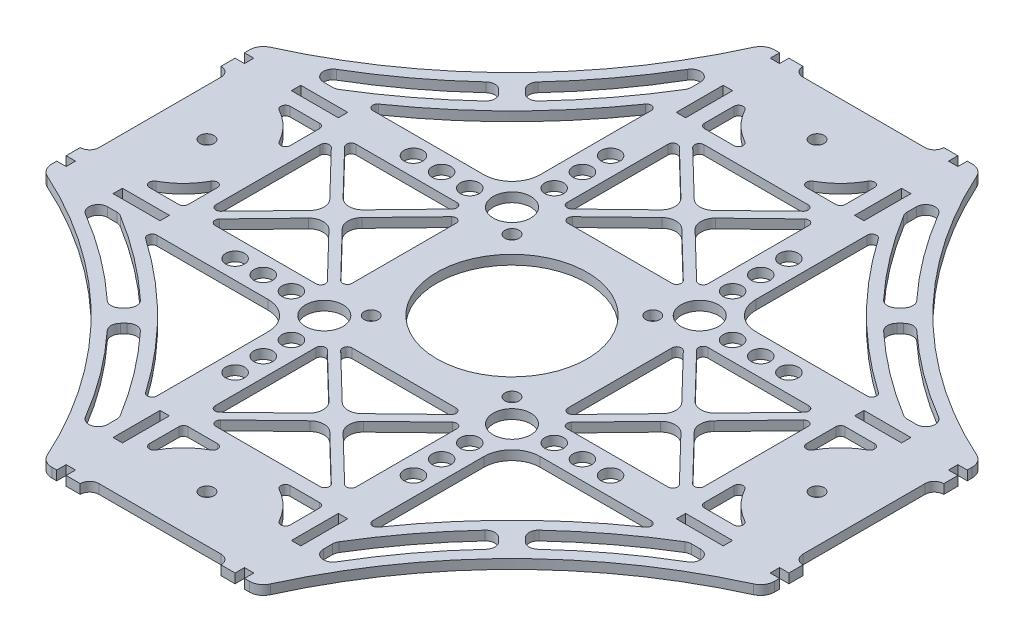
from build123d import *

# Parameters (mm, degrees)
SKETCH1_R           = 16
SKETCH1_R_2         = 1.5
SKETCH1_R_3         = 4
SKETCH1_R_4         = 2
SKETCH1_W           = 2
SKETCH1_H           = 10
SKETCH1_W_2         = 10
SKETCH1_H_2         = 2
BOSS_EXTRUDE1_DEPTH = 2


with BuildPart() as part:
    # Sketch1 → Boss-Extrude1 (new body)
    with BuildSketch(Plane(origin=(0, 0, 0), x_dir=(1, 0, 0), z_dir=(0, 1, 0))):
        with BuildLine():
            Line((-21.047576382, 77), (-20, 77))
            Line((-20, 77), (-20, 75))
            Line((-20, 75), (-18, 75))
            Line((-18, 75), (-18, 77))
            Line((-18, 77), (-15, 77))
            ThreePointArc((-15, 77), (-14.414213562, 75.585786438), (-13, 75))
            Line((-13, 75), (13, 75))
            ThreePointArc((13, 75), (14.414213562, 75.585786438), (15, 77))
            Line((15, 77), (18, 77))
            Line((18, 77), (18, 75))
            Line((18, 75), (20, 75))
            Line((20, 75), (20, 77))
            Line((20, 77), (21.047576382, 77))
            ThreePointArc((21.047576382, 77), (22.672345392, 76.521928957), (23.779277725, 75.240083776))
            ThreePointArc((23.779277725, 75.240083776), (44.837422207, 44.837422207), (75.240083776, 23.779277725))
            ThreePointArc((75.240083776, 23.779277725), (76.521928957, 22.672345392), (77, 21.047576382))
            Line((77, 21.047576382), (77, 20))
            Line((77, 20), (75, 20))
            Line((75, 20), (75, 18))
            Line((75, 18), (77, 18))
            Line((77, 18), (77, 15))
            ThreePointArc((77, 15), (75.585786438, 14.414213562), (75, 13))
            Line((75, 13), (75, -13))
            ThreePointArc((75, -13), (75.585786438, -14.414213562), (77, -15))
            Line((77, -15), (77, -18))
            Line((77, -18), (75, -18))
            Line((75, -18), (75, -20))
            Line((75, -20), (77, -20))
            Line((77, -20), (77, -21.047576382))
            ThreePointArc((77, -21.047576382), (76.521928957, -22.672345392), (75.240083776, -23.779277725))
            ThreePointArc((75.240083776, -23.779277725), (44.837422207, -44.837422207), (23.779277725, -75.240083776))
            ThreePointArc((23.779277725, -75.240083776), (22.672345392, -76.521928957), (21.047576382, -77))
            Line((21.047576382, -77), (20, -77))
            Line((20, -77), (20, -75))
            Line((20, -75), (18, -75))
            Line((18, -75), (18, -77))
            Line((18, -77), (15, -77))
            ThreePointArc((15, -77), (14.414213562, -75.585786438), (13, -75))
            Line((13, -75), (-13, -75))
            ThreePointArc((-13, -75), (-14.414213562, -75.585786438), (-15, -77))
            Line((-15, -77), (-18, -77))
            Line((-18, -77), (-18, -75))
            Line((-18, -75), (-20, -75))
            Line((-20, -75), (-20, -77))
            Line((-20, -77), (-21.047576382, -77))
            ThreePointArc((-21.047576382, -77), (-22.672345392, -76.521928957), (-23.779277725, -75.240083776))
            ThreePointArc((-23.779277725, -75.240083776), (-44.837422207, -44.837422207), (-75.240083776, -23.779277725))
            ThreePointArc((-75.240083776, -23.779277725), (-76.521928957, -22.672345392), (-77, -21.047576382))
            Line((-77, -21.047576382), (-77, -20))
            Line((-77, -20), (-75, -20))
            Line((-75, -20), (-75, -18))
            Line((-75, -18), (-77, -18))
            Line((-77, -18), (-77, -15))
            ThreePointArc((-77, -15), (-75.585786438, -14.414213562), (-75, -13))
            Line((-75, -13), (-75, 13))
            ThreePointArc((-75, 13), (-75.585786438, 14.414213562), (-77, 15))
            Line((-77, 15), (-77, 18))
            Line((-77, 18), (-75, 18))
            Line((-75, 18), (-75, 20))
            Line((-75, 20), (-77, 20))
            Line((-77, 20), (-77, 21.047576382))
            ThreePointArc((-77, 21.047576382), (-76.521928957, 22.672345392), (-75.240083776, 23.779277725))
            ThreePointArc((-75.240083776, 23.779277725), (-44.837422207, 44.837422207), (-23.779277725, 75.240083776))
            ThreePointArc((-23.779277725, 75.240083776), (-22.672345392, 76.521928957), (-21.047576382, 77))
        make_face()
        with Locations(Location((0, 0, 0), (0, 0, 270))):
            Circle(SKETCH1_R, mode=Mode.SUBTRACT)
        with Locations(Location((0, 65, 0), (0, 0, 270))):
            Circle(SKETCH1_R_2, mode=Mode.SUBTRACT)
        with Locations(Location((65, 0, 0), (0, 0, 270))):
            Circle(SKETCH1_R_2, mode=Mode.SUBTRACT)
        with Locations(Location((0, -65, 0), (0, 0, 270))):
            Circle(SKETCH1_R_2, mode=Mode.SUBTRACT)
        with Locations(Location((20, 20, 0), (0, 0, 270))):
            Circle(SKETCH1_R_3, mode=Mode.SUBTRACT)
        with Locations(Location((15, 15, 0), (0, 0, 270))):
            Circle(SKETCH1_R_2, mode=Mode.SUBTRACT)
        with Locations(Location((19, 28, 0), (0, 0, 270))):
            Circle(SKETCH1_R_4, mode=Mode.SUBTRACT)
        with Locations(Location((19, 34, 0), (0, 0, 270))):
            Circle(SKETCH1_R_4, mode=Mode.SUBTRACT)
        with Locations(Location((19, 40, 0), (0, 0, 270))):
            Circle(SKETCH1_R_4, mode=Mode.SUBTRACT)
        with Locations(Location((28, 19, 0), (0, 0, 270))):
            Circle(SKETCH1_R_4, mode=Mode.SUBTRACT)
        with Locations(Location((34, 19, 0), (0, 0, 270))):
            Circle(SKETCH1_R_4, mode=Mode.SUBTRACT)
        with Locations(Location((-65, 0, 0), (0, 0, 270))):
            Circle(SKETCH1_R_2, mode=Mode.SUBTRACT)
        with Locations(Location((40, 19, 0), (0, 0, 270))):
            Circle(SKETCH1_R_4, mode=Mode.SUBTRACT)
        with Locations(Location((19, -40, 0), (0, 0, 270))):
            Circle(SKETCH1_R_4, mode=Mode.SUBTRACT)
        with Locations(Location((19, -34, 0), (0, 0, 270))):
            Circle(SKETCH1_R_4, mode=Mode.SUBTRACT)
        with Locations(Location((19, -28, 0), (0, 0, 270))):
            Circle(SKETCH1_R_4, mode=Mode.SUBTRACT)
        with Locations(Location((20, -20, 0), (0, 0, 270))):
            Circle(SKETCH1_R_3, mode=Mode.SUBTRACT)
        with Locations(Location((28, -19, 0), (0, 0, 270))):
            Circle(SKETCH1_R_4, mode=Mode.SUBTRACT)
        with Locations(Location((34, -19, 0), (0, 0, 270))):
            Circle(SKETCH1_R_4, mode=Mode.SUBTRACT)
        with Locations(Location((40, -19, 0), (0, 0, 270))):
            Circle(SKETCH1_R_4, mode=Mode.SUBTRACT)
        with Locations(Location((15, -15, 0), (0, 0, 270))):
            Circle(SKETCH1_R_2, mode=Mode.SUBTRACT)
        with Locations(Location((-40, -19, 0), (0, 0, 270))):
            Circle(SKETCH1_R_4, mode=Mode.SUBTRACT)
        with Locations(Location((-34, -19, 0), (0, 0, 270))):
            Circle(SKETCH1_R_4, mode=Mode.SUBTRACT)
        with Locations(Location((-28, -19, 0), (0, 0, 270))):
            Circle(SKETCH1_R_4, mode=Mode.SUBTRACT)
        with Locations(Location((-20, -20, 0), (0, 0, 270))):
            Circle(SKETCH1_R_3, mode=Mode.SUBTRACT)
        with Locations(Location((-19, -28, 0), (0, 0, 270))):
            Circle(SKETCH1_R_4, mode=Mode.SUBTRACT)
        with Locations(Location((-19, -34, 0), (0, 0, 270))):
            Circle(SKETCH1_R_4, mode=Mode.SUBTRACT)
        with Locations(Location((-19, -40, 0), (0, 0, 270))):
            Circle(SKETCH1_R_4, mode=Mode.SUBTRACT)
        with Locations(Location((-15, -15, 0), (0, 0, 270))):
            Circle(SKETCH1_R_2, mode=Mode.SUBTRACT)
        with Locations(Location((-19, 40, 0), (0, 0, 270))):
            Circle(SKETCH1_R_4, mode=Mode.SUBTRACT)
        with Locations(Location((-19, 34, 0), (0, 0, 270))):
            Circle(SKETCH1_R_4, mode=Mode.SUBTRACT)
        with Locations(Location((-19, 28, 0), (0, 0, 270))):
            Circle(SKETCH1_R_4, mode=Mode.SUBTRACT)
        with Locations(Location((-20, 20, 0), (0, 0, 270))):
            Circle(SKETCH1_R_3, mode=Mode.SUBTRACT)
        with Locations(Location((-28, 19, 0), (0, 0, 270))):
            Circle(SKETCH1_R_4, mode=Mode.SUBTRACT)
        with Locations(Location((-34, 19, 0), (0, 0, 270))):
            Circle(SKETCH1_R_4, mode=Mode.SUBTRACT)
        with Locations(Location((-40, 19, 0), (0, 0, 270))):
            Circle(SKETCH1_R_4, mode=Mode.SUBTRACT)
        with Locations(Location((-15, 15, 0), (0, 0, 270))):
            Circle(SKETCH1_R_2, mode=Mode.SUBTRACT)
        with BuildLine():
            Line((23, 52.678269999), (23, 29))
            ThreePointArc((23, 29), (24.757359313, 24.757359313), (29, 23))
            Line((29, 23), (52.678269999, 23))
            ThreePointArc((52.678269999, 23), (53.632513507, 23.700969354), (53.248966104, 24.821161346))
            ThreePointArc((53.248966104, 24.821161346), (37.766354396, 37.766354396), (24.821161346, 53.248966104))
            ThreePointArc((24.821161346, 53.248966104), (23.700969354, 53.632513507), (23, 52.678269999))
        make_face(mode=Mode.SUBTRACT)
        with BuildLine():
            Line((52.678269999, -23), (29, -23))
            ThreePointArc((29, -23), (24.757359313, -24.757359313), (23, -29))
            Line((23, -29), (23, -52.678269999))
            ThreePointArc((23, -52.678269999), (23.700969354, -53.632513507), (24.821161346, -53.248966104))
            ThreePointArc((24.821161346, -53.248966104), (37.766354396, -37.766354396), (53.248966104, -24.821161346))
            ThreePointArc((53.248966104, -24.821161346), (53.632513507, -23.700969354), (52.678269999, -23))
        make_face(mode=Mode.SUBTRACT)
        with BuildLine():
            Line((-23, -52.678269999), (-23, -29))
            ThreePointArc((-23, -29), (-24.757359313, -24.757359313), (-29, -23))
            Line((-29, -23), (-52.678269999, -23))
            ThreePointArc((-52.678269999, -23), (-53.632513507, -23.700969354), (-53.248966104, -24.821161346))
            ThreePointArc((-53.248966104, -24.821161346), (-37.766354396, -37.766354396), (-24.821161346, -53.248966104))
            ThreePointArc((-24.821161346, -53.248966104), (-23.700969354, -53.632513507), (-23, -52.678269999))
        make_face(mode=Mode.SUBTRACT)
        with BuildLine():
            Line((-52.678269999, 23), (-29, 23))
            ThreePointArc((-29, 23), (-24.757359313, 24.757359313), (-23, 29))
            Line((-23, 29), (-23, 52.678269999))
            ThreePointArc((-23, 52.678269999), (-23.700969354, 53.632513507), (-24.821161346, 53.248966104))
            ThreePointArc((-24.821161346, 53.248966104), (-37.766354396, 37.766354396), (-53.248966104, 24.821161346))
            ThreePointArc((-53.248966104, 24.821161346), (-53.632513507, 23.700969354), (-52.678269999, 23))
        make_face(mode=Mode.SUBTRACT)
        with BuildLine():
            Line((-15, 62.254033308), (-15, 56))
            ThreePointArc((-15, 56), (-14.707106781, 55.292893219), (-14, 55))
            Line((-14, 55), (-7.745966692, 55))
            ThreePointArc((-7.745966692, 55), (-6.777720856, 55.75), (-7.261843774, 56.875))
            ThreePointArc((-7.261843774, 56.875), (-10.606601718, 59.393398282), (-13.125, 62.738156226))
            ThreePointArc((-13.125, 62.738156226), (-14.25, 63.222279144), (-15, 62.254033308))
        make_face(mode=Mode.SUBTRACT)
        with BuildLine():
            Line((15, 62.254033308), (15, 56))
            ThreePointArc((15, 56), (14.707106781, 55.292893219), (14, 55))
            Line((14, 55), (7.745966692, 55))
            ThreePointArc((7.745966692, 55), (6.777720856, 55.75), (7.261843774, 56.875))
            ThreePointArc((7.261843774, 56.875), (10.606601718, 59.393398282), (13.125, 62.738156226))
            ThreePointArc((13.125, 62.738156226), (14.25, 63.222279144), (15, 62.254033308))
        make_face(mode=Mode.SUBTRACT)
        with BuildLine():
            Line((-11.08791089, 52), (11.08791089, 52))
            ThreePointArc((11.08791089, 52), (12.014999984, 51.374841049), (11.782932987, 50.281011624))
            Line((11.782932987, 50.281011624), (2.085066291, 40.906407151))
            ThreePointArc((2.085066291, 40.906407151), (0, 40.063372279), (-2.085066291, 40.906407151))
            Line((-2.085066291, 40.906407151), (-11.782932987, 50.281011624))
            ThreePointArc((-11.782932987, 50.281011624), (-12.014999984, 51.374841049), (-11.08791089, 52))
        make_face(mode=Mode.SUBTRACT)
        with BuildLine():
            Line((-11.08791089, 23), (11.08791089, 23))
            ThreePointArc((11.08791089, 23), (12.014999984, 23.625158951), (11.782932987, 24.718988376))
            Line((11.782932987, 24.718988376), (2.085066291, 34.09359285))
            ThreePointArc((2.085066291, 34.09359285), (0, 34.936627721), (-2.085066291, 34.09359285))
            Line((-2.085066291, 34.09359285), (-11.782932987, 24.718988376))
            ThreePointArc((-11.782932987, 24.718988376), (-12.014999984, 23.625158951), (-11.08791089, 23))
        make_face(mode=Mode.SUBTRACT)
        with BuildLine():
            Line((-15, 48.251647194), (-15, 26.748352806))
            ThreePointArc((-15, 26.748352806), (-14.390498337, 25.827749173), (-13.304977903, 26.02936443))
            Line((-13.304977903, 26.02936443), (-3.670146412, 35.343034872))
            ThreePointArc((-3.670146412, 35.343034872), (-2.755212702, 37.5), (-3.670146412, 39.656965128))
            Line((-3.670146412, 39.656965128), (-13.304977903, 48.97063557))
            ThreePointArc((-13.304977903, 48.97063557), (-14.390498337, 49.172250827), (-15, 48.251647194))
        make_face(mode=Mode.SUBTRACT)
        with BuildLine():
            Line((15, 48.251647194), (15, 26.748352806))
            ThreePointArc((15, 26.748352806), (14.390498337, 25.827749173), (13.304977903, 26.02936443))
            Line((13.304977903, 26.02936443), (3.670146412, 35.343034872))
            ThreePointArc((3.670146412, 35.343034872), (2.755212702, 37.5), (3.670146412, 39.656965128))
            Line((3.670146412, 39.656965128), (13.304977903, 48.97063557))
            ThreePointArc((13.304977903, 48.97063557), (14.390498337, 49.172250827), (15, 48.251647194))
        make_face(mode=Mode.SUBTRACT)
        with BuildLine():
            Line((55, 14), (55, 7.745966692))
            ThreePointArc((55, 7.745966692), (55.75, 6.777720856), (56.875, 7.261843774))
            ThreePointArc((56.875, 7.261843774), (59.393398282, 10.606601718), (62.738156226, 13.125))
            ThreePointArc((62.738156226, 13.125), (63.222279144, 14.25), (62.254033308, 15))
            Line((62.254033308, 15), (56, 15))
            ThreePointArc((56, 15), (55.292893219, 14.707106781), (55, 14))
        make_face(mode=Mode.SUBTRACT)
        with BuildLine():
            Line((62.254033308, -15), (56, -15))
            ThreePointArc((56, -15), (55.292893219, -14.707106781), (55, -14))
            Line((55, -14), (55, -7.745966692))
            ThreePointArc((55, -7.745966692), (55.75, -6.777720856), (56.875, -7.261843774))
            ThreePointArc((56.875, -7.261843774), (59.393398282, -10.606601718), (62.738156226, -13.125))
            ThreePointArc((62.738156226, -13.125), (63.222279144, -14.25), (62.254033308, -15))
        make_face(mode=Mode.SUBTRACT)
        with BuildLine():
            Line((39.586036578, 42.414463703), (40.293624385, 43.122051509))
            ThreePointArc((40.293624385, 43.122051509), (40.879067739, 44.49922168), (40.345032364, 45.897130053))
            ThreePointArc((40.345032364, 45.897130053), (33.041334339, 54.66588361), (26.722647668, 64.169001128))
            ThreePointArc((26.722647668, 64.169001128), (24.473357491, 65.082304837), (23, 63.152888431))
            Line((23, 63.152888431), (23, 61.209891967))
            ThreePointArc((23, 61.209891967), (23.074683517, 60.668452737), (23.293156439, 60.167450093))
            ThreePointArc((23.293156439, 60.167450093), (29.556124634, 50.981072591), (36.706664281, 42.467314021))
            ThreePointArc((36.706664281, 42.467314021), (38.135119587, 41.829014079), (39.586036578, 42.414463703))
        make_face(mode=Mode.SUBTRACT)
        with BuildLine():
            Line((61.209891966, 23), (63.152888431, 23))
            ThreePointArc((63.152888431, 23), (65.082304837, 24.473357491), (64.169001128, 26.722647668))
            ThreePointArc((64.169001128, 26.722647668), (54.66588361, 33.041334339), (45.897130053, 40.345032364))
            ThreePointArc((45.897130053, 40.345032364), (44.49922168, 40.879067739), (43.122051509, 40.293624385))
            Line((43.122051509, 40.293624385), (42.414463703, 39.586036578))
            ThreePointArc((42.414463703, 39.586036578), (41.829014079, 38.135119587), (42.467314021, 36.706664281))
            ThreePointArc((42.467314021, 36.706664281), (50.981072591, 29.556124634), (60.167450093, 23.293156439))
            ThreePointArc((60.167450093, 23.293156439), (60.668452737, 23.074683517), (61.209891966, 23))
        make_face(mode=Mode.SUBTRACT)
        with BuildLine():
            Line((61.209891967, -23), (63.152888431, -23))
            ThreePointArc((63.152888431, -23), (65.082304837, -24.473357491), (64.169001128, -26.722647668))
            ThreePointArc((64.169001128, -26.722647668), (54.66588361, -33.041334339), (45.897130053, -40.345032364))
            ThreePointArc((45.897130053, -40.345032364), (44.49922168, -40.879067739), (43.122051509, -40.293624385))
            Line((43.122051509, -40.293624385), (42.414463703, -39.586036578))
            ThreePointArc((42.414463703, -39.586036578), (41.829014079, -38.135119587), (42.467314021, -36.706664281))
            ThreePointArc((42.467314021, -36.706664281), (50.981072591, -29.556124634), (60.167450093, -23.293156439))
            ThreePointArc((60.167450093, -23.293156439), (60.668452737, -23.074683517), (61.209891967, -23))
        make_face(mode=Mode.SUBTRACT)
        with BuildLine():
            Line((39.586036578, -42.414463703), (40.293624385, -43.122051509))
            ThreePointArc((40.293624385, -43.122051509), (40.879067739, -44.49922168), (40.345032364, -45.897130053))
            ThreePointArc((40.345032364, -45.897130053), (33.041334339, -54.66588361), (26.722647668, -64.169001128))
            ThreePointArc((26.722647668, -64.169001128), (24.473357491, -65.082304837), (23, -63.152888431))
            Line((23, -63.152888431), (23, -61.209891966))
            ThreePointArc((23, -61.209891966), (23.074683517, -60.668452737), (23.293156439, -60.167450093))
            ThreePointArc((23.293156439, -60.167450093), (29.556124634, -50.981072591), (36.706664281, -42.467314021))
            ThreePointArc((36.706664281, -42.467314021), (38.135119587, -41.829014079), (39.586036578, -42.414463703))
        make_face(mode=Mode.SUBTRACT)
        with BuildLine():
            Line((-62.254033308, 15), (-56, 15))
            ThreePointArc((-56, 15), (-55.292893219, 14.707106781), (-55, 14))
            Line((-55, 14), (-55, 7.745966692))
            ThreePointArc((-55, 7.745966692), (-55.75, 6.777720856), (-56.875, 7.261843774))
            ThreePointArc((-56.875, 7.261843774), (-59.393398282, 10.606601718), (-62.738156226, 13.125))
            ThreePointArc((-62.738156226, 13.125), (-63.222279144, 14.25), (-62.254033308, 15))
        make_face(mode=Mode.SUBTRACT)
        with BuildLine():
            Line((-23, -61.209891967), (-23, -63.152888431))
            ThreePointArc((-23, -63.152888431), (-24.473357491, -65.082304837), (-26.722647668, -64.169001128))
            ThreePointArc((-26.722647668, -64.169001128), (-33.041334339, -54.66588361), (-40.345032364, -45.897130053))
            ThreePointArc((-40.345032364, -45.897130053), (-40.879067739, -44.49922168), (-40.293624385, -43.122051509))
            Line((-40.293624385, -43.122051509), (-39.586036578, -42.414463703))
            ThreePointArc((-39.586036578, -42.414463703), (-38.135119587, -41.829014079), (-36.706664281, -42.467314021))
            ThreePointArc((-36.706664281, -42.467314021), (-29.556124634, -50.981072591), (-23.293156439, -60.167450093))
            ThreePointArc((-23.293156439, -60.167450093), (-23.074683517, -60.668452737), (-23, -61.209891967))
        make_face(mode=Mode.SUBTRACT)
        with BuildLine():
            Line((-42.414463703, -39.586036578), (-43.122051509, -40.293624385))
            ThreePointArc((-43.122051509, -40.293624385), (-44.49922168, -40.879067739), (-45.897130053, -40.345032364))
            ThreePointArc((-45.897130053, -40.345032364), (-54.66588361, -33.041334339), (-64.169001128, -26.722647668))
            ThreePointArc((-64.169001128, -26.722647668), (-65.082304837, -24.473357491), (-63.152888431, -23))
            Line((-63.152888431, -23), (-61.209891966, -23))
            ThreePointArc((-61.209891966, -23), (-60.668452737, -23.074683517), (-60.167450093, -23.293156439))
            ThreePointArc((-60.167450093, -23.293156439), (-50.981072591, -29.556124634), (-42.467314021, -36.706664281))
            ThreePointArc((-42.467314021, -36.706664281), (-41.829014079, -38.135119587), (-42.414463703, -39.586036578))
        make_face(mode=Mode.SUBTRACT)
        with BuildLine():
            Line((14, -55), (7.745966692, -55))
            ThreePointArc((7.745966692, -55), (6.777720856, -55.75), (7.261843774, -56.875))
            ThreePointArc((7.261843774, -56.875), (10.606601718, -59.393398282), (13.125, -62.738156226))
            ThreePointArc((13.125, -62.738156226), (14.25, -63.222279144), (15, -62.254033308))
            Line((15, -62.254033308), (15, -56))
            ThreePointArc((15, -56), (14.707106781, -55.292893219), (14, -55))
        make_face(mode=Mode.SUBTRACT)
        with BuildLine():
            Line((-15, -62.254033308), (-15, -56))
            ThreePointArc((-15, -56), (-14.707106781, -55.292893219), (-14, -55))
            Line((-14, -55), (-7.745966692, -55))
            ThreePointArc((-7.745966692, -55), (-6.777720856, -55.75), (-7.261843774, -56.875))
            ThreePointArc((-7.261843774, -56.875), (-10.606601718, -59.393398282), (-13.125, -62.738156226))
            ThreePointArc((-13.125, -62.738156226), (-14.25, -63.222279144), (-15, -62.254033308))
        make_face(mode=Mode.SUBTRACT)
        with BuildLine():
            Line((-55, -14), (-55, -7.745966692))
            ThreePointArc((-55, -7.745966692), (-55.75, -6.777720856), (-56.875, -7.261843774))
            ThreePointArc((-56.875, -7.261843774), (-59.393398282, -10.606601718), (-62.738156226, -13.125))
            ThreePointArc((-62.738156226, -13.125), (-63.222279144, -14.25), (-62.254033308, -15))
            Line((-62.254033308, -15), (-56, -15))
            ThreePointArc((-56, -15), (-55.292893219, -14.707106781), (-55, -14))
        make_face(mode=Mode.SUBTRACT)
        with BuildLine():
            Line((48.251647194, 15), (26.748352806, 15))
            ThreePointArc((26.748352806, 15), (25.827749173, 14.390498337), (26.02936443, 13.304977903))
            Line((26.02936443, 13.304977903), (35.343034872, 3.670146412))
            ThreePointArc((35.343034872, 3.670146412), (37.5, 2.755212702), (39.656965128, 3.670146412))
            Line((39.656965128, 3.670146412), (48.97063557, 13.304977903))
            ThreePointArc((48.97063557, 13.304977903), (49.172250827, 14.390498337), (48.251647194, 15))
        make_face(mode=Mode.SUBTRACT)
        with BuildLine():
            Line((24.718988376, 11.782932987), (34.09359285, 2.085066291))
            ThreePointArc((34.09359285, 2.085066291), (34.936627721, 0), (34.09359285, -2.085066291))
            Line((34.09359285, -2.085066291), (24.718988376, -11.782932987))
            ThreePointArc((24.718988376, -11.782932987), (23.625158951, -12.014999984), (23, -11.08791089))
            Line((23, -11.08791089), (23, 11.08791089))
            ThreePointArc((23, 11.08791089), (23.625158951, 12.014999984), (24.718988376, 11.782932987))
        make_face(mode=Mode.SUBTRACT)
        with BuildLine():
            Line((48.251647194, -15), (26.748352806, -15))
            ThreePointArc((26.748352806, -15), (25.827749173, -14.390498337), (26.02936443, -13.304977903))
            Line((26.02936443, -13.304977903), (35.343034872, -3.670146412))
            ThreePointArc((35.343034872, -3.670146412), (37.5, -2.755212702), (39.656965128, -3.670146412))
            Line((39.656965128, -3.670146412), (48.97063557, -13.304977903))
            ThreePointArc((48.97063557, -13.304977903), (49.172250827, -14.390498337), (48.251647194, -15))
        make_face(mode=Mode.SUBTRACT)
        with BuildLine():
            Line((40.906407151, -2.085066291), (50.281011624, -11.782932987))
            ThreePointArc((50.281011624, -11.782932987), (51.374841049, -12.014999984), (52, -11.08791089))
            Line((52, -11.08791089), (52, 11.08791089))
            ThreePointArc((52, 11.08791089), (51.374841049, 12.014999984), (50.281011624, 11.782932987))
            Line((50.281011624, 11.782932987), (40.906407151, 2.085066291))
            ThreePointArc((40.906407151, 2.085066291), (40.063372279, 0), (40.906407151, -2.085066291))
        make_face(mode=Mode.SUBTRACT)
        with BuildLine():
            Line((15, -48.251647194), (15, -26.748352806))
            ThreePointArc((15, -26.748352806), (14.390498337, -25.827749173), (13.304977903, -26.02936443))
            Line((13.304977903, -26.02936443), (3.670146412, -35.343034872))
            ThreePointArc((3.670146412, -35.343034872), (2.755212702, -37.5), (3.670146412, -39.656965128))
            Line((3.670146412, -39.656965128), (13.304977903, -48.97063557))
            ThreePointArc((13.304977903, -48.97063557), (14.390498337, -49.172250827), (15, -48.251647194))
        make_face(mode=Mode.SUBTRACT)
        with BuildLine():
            Line((11.782932987, -24.718988376), (2.085066291, -34.093592849))
            ThreePointArc((2.085066291, -34.093592849), (0, -34.936627721), (-2.085066291, -34.09359285))
            Line((-2.085066291, -34.09359285), (-11.782932987, -24.718988376))
            ThreePointArc((-11.782932987, -24.718988376), (-12.014999984, -23.625158951), (-11.08791089, -23))
            Line((-11.08791089, -23), (11.08791089, -23))
            ThreePointArc((11.08791089, -23), (12.014999984, -23.625158951), (11.782932987, -24.718988376))
        make_face(mode=Mode.SUBTRACT)
        with BuildLine():
            Line((-15, -48.251647194), (-15, -26.748352806))
            ThreePointArc((-15, -26.748352806), (-14.390498337, -25.827749173), (-13.304977903, -26.02936443))
            Line((-13.304977903, -26.02936443), (-3.670146412, -35.343034872))
            ThreePointArc((-3.670146412, -35.343034872), (-2.755212702, -37.5), (-3.670146412, -39.656965128))
            Line((-3.670146412, -39.656965128), (-13.304977903, -48.97063557))
            ThreePointArc((-13.304977903, -48.97063557), (-14.390498337, -49.172250827), (-15, -48.251647194))
        make_face(mode=Mode.SUBTRACT)
        with BuildLine():
            Line((-2.085066291, -40.906407151), (-11.782932987, -50.281011624))
            ThreePointArc((-11.782932987, -50.281011624), (-12.014999984, -51.374841049), (-11.08791089, -52))
            Line((-11.08791089, -52), (11.08791089, -52))
            ThreePointArc((11.08791089, -52), (12.014999984, -51.374841049), (11.782932987, -50.281011624))
            Line((11.782932987, -50.281011624), (2.085066291, -40.906407151))
            ThreePointArc((2.085066291, -40.906407151), (0, -40.063372279), (-2.085066291, -40.906407151))
        make_face(mode=Mode.SUBTRACT)
        with BuildLine():
            Line((-48.251647194, -15), (-26.748352806, -15))
            ThreePointArc((-26.748352806, -15), (-25.827749173, -14.390498337), (-26.02936443, -13.304977903))
            Line((-26.02936443, -13.304977903), (-35.343034872, -3.670146412))
            ThreePointArc((-35.343034872, -3.670146412), (-37.5, -2.755212702), (-39.656965128, -3.670146412))
            Line((-39.656965128, -3.670146412), (-48.97063557, -13.304977903))
            ThreePointArc((-48.97063557, -13.304977903), (-49.172250827, -14.390498337), (-48.251647194, -15))
        make_face(mode=Mode.SUBTRACT)
        with BuildLine():
            Line((-24.718988376, -11.782932987), (-34.093592849, -2.085066291))
            ThreePointArc((-34.093592849, -2.085066291), (-34.936627721, 0), (-34.09359285, 2.085066291))
            Line((-34.09359285, 2.085066291), (-24.718988376, 11.782932987))
            ThreePointArc((-24.718988376, 11.782932987), (-23.625158951, 12.014999984), (-23, 11.08791089))
            Line((-23, 11.08791089), (-23, -11.08791089))
            ThreePointArc((-23, -11.08791089), (-23.625158951, -12.014999984), (-24.718988376, -11.782932987))
        make_face(mode=Mode.SUBTRACT)
        with BuildLine():
            Line((-48.251647194, 15), (-26.748352806, 15))
            ThreePointArc((-26.748352806, 15), (-25.827749173, 14.390498337), (-26.02936443, 13.304977903))
            Line((-26.02936443, 13.304977903), (-35.343034872, 3.670146412))
            ThreePointArc((-35.343034872, 3.670146412), (-37.5, 2.755212702), (-39.656965128, 3.670146412))
            Line((-39.656965128, 3.670146412), (-48.97063557, 13.304977903))
            ThreePointArc((-48.97063557, 13.304977903), (-49.172250827, 14.390498337), (-48.251647194, 15))
        make_face(mode=Mode.SUBTRACT)
        with BuildLine():
            Line((-40.906407151, 2.085066291), (-50.281011624, 11.782932987))
            ThreePointArc((-50.281011624, 11.782932987), (-51.374841049, 12.014999984), (-52, 11.08791089))
            Line((-52, 11.08791089), (-52, -11.08791089))
            ThreePointArc((-52, -11.08791089), (-51.374841049, -12.014999984), (-50.281011624, -11.782932987))
            Line((-50.281011624, -11.782932987), (-40.906407151, -2.085066291))
            ThreePointArc((-40.906407151, -2.085066291), (-40.063372279, 0), (-40.906407151, 2.085066291))
        make_face(mode=Mode.SUBTRACT)
        with Locations((19, 60)):
            Rectangle(SKETCH1_W, SKETCH1_H, mode=Mode.SUBTRACT)
        with Locations((-19, 60)):
            Rectangle(SKETCH1_W, SKETCH1_H, mode=Mode.SUBTRACT)
        with Locations((60, 19)):
            Rectangle(SKETCH1_W_2, SKETCH1_H_2, mode=Mode.SUBTRACT)
        with Locations((60, -19)):
            Rectangle(SKETCH1_W_2, SKETCH1_H_2, mode=Mode.SUBTRACT)
        with Locations((19, -60)):
            Rectangle(SKETCH1_W, SKETCH1_H, mode=Mode.SUBTRACT)
        with Locations((-19, -60)):
            Rectangle(SKETCH1_W, SKETCH1_H, mode=Mode.SUBTRACT)
        with Locations((-60, -19)):
            Rectangle(SKETCH1_W_2, SKETCH1_H_2, mode=Mode.SUBTRACT)
        with Locations((-60, 19)):
            Rectangle(SKETCH1_W_2, SKETCH1_H_2, mode=Mode.SUBTRACT)
        with BuildLine():
            Line((-61.209891967, 23), (-63.152888431, 23))
            ThreePointArc((-63.152888431, 23), (-65.082304837, 24.473357491), (-64.169001128, 26.722647668))
            ThreePointArc((-64.169001128, 26.722647668), (-54.66588361, 33.041334339), (-45.897130053, 40.345032364))
            ThreePointArc((-45.897130053, 40.345032364), (-44.49922168, 40.879067739), (-43.122051509, 40.293624385))
            Line((-43.122051509, 40.293624385), (-42.414463703, 39.586036578))
            ThreePointArc((-42.414463703, 39.586036578), (-41.829014079, 38.135119587), (-42.467314021, 36.706664281))
            ThreePointArc((-42.467314021, 36.706664281), (-50.981072591, 29.556124634), (-60.167450093, 23.293156439))
            ThreePointArc((-60.167450093, 23.293156439), (-60.668452737, 23.074683517), (-61.209891967, 23))
        make_face(mode=Mode.SUBTRACT)
        with BuildLine():
            Line((-39.586036578, 42.414463703), (-40.293624385, 43.122051509))
            ThreePointArc((-40.293624385, 43.122051509), (-40.879067739, 44.49922168), (-40.345032364, 45.897130053))
            ThreePointArc((-40.345032364, 45.897130053), (-33.041334339, 54.66588361), (-26.722647668, 64.169001128))
            ThreePointArc((-26.722647668, 64.169001128), (-24.473357491, 65.082304837), (-23, 63.152888431))
            Line((-23, 63.152888431), (-23, 61.209891966))
            ThreePointArc((-23, 61.209891966), (-23.074683517, 60.668452737), (-23.293156439, 60.167450093))
            ThreePointArc((-23.293156439, 60.167450093), (-29.556124634, 50.981072591), (-36.706664281, 42.467314021))
            ThreePointArc((-36.706664281, 42.467314021), (-38.135119587, 41.829014079), (-39.586036578, 42.414463703))
        make_face(mode=Mode.SUBTRACT)
    extrude(amount=BOSS_EXTRUDE1_DEPTH)


solid = part.part
